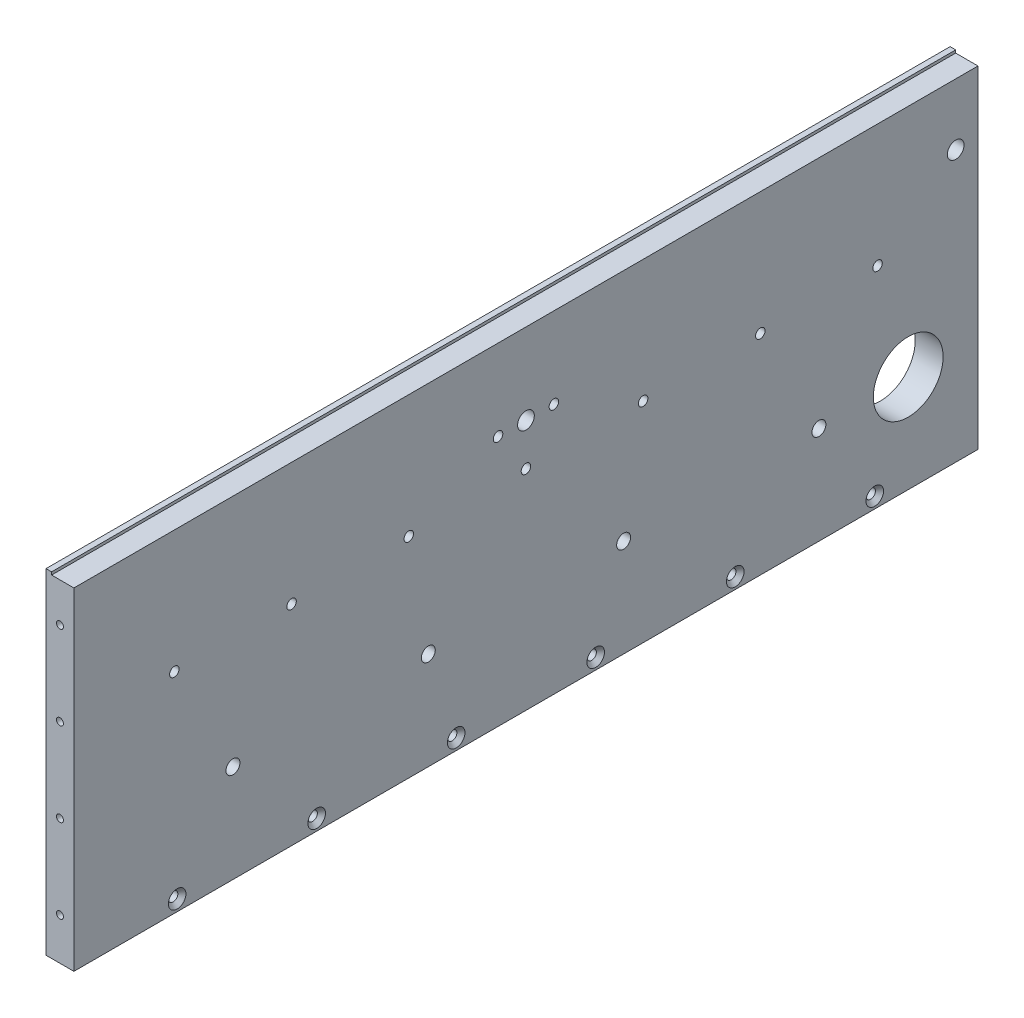
from build123d import *

# Parameters (mm, degrees)
SKETCH1_W                                       = 324
SKETCH1_H                                       = 40
BOSS_EXTRUDE1_DEPTH                             = 10
G1_4_TAPPED_HOLE1_D                             = 6
CSK_FOR_M3_COUNTERSUNK_FLAT_HEAD1_D             = 3.4
CSK_FOR_M3_COUNTERSUNK_FLAT_HEAD1_CSINK_D       = 6.3
CSK_FOR_M3_COUNTERSUNK_FLAT_HEAD1_CSINK_ANGLE   = 90
SKETCH9_W                                       = 10
SKETCH9_H                                       = 324
BOSS_EXTRUDE2_DEPTH                             = 80
CSK_FOR_M3_COUNTERSUNK_FLAT_HEAD2_D             = 3.4
CSK_FOR_M3_COUNTERSUNK_FLAT_HEAD2_DEPTH         = 11.5
CSK_FOR_M3_COUNTERSUNK_FLAT_HEAD2_CSINK_D       = 6.3
CSK_FOR_M3_COUNTERSUNK_FLAT_HEAD2_CSINK_ANGLE   = 90
CSK_FOR_M3_COUNTERSUNK_FLAT_HEAD2_TIP           = 1.021463052
M3X0_5_TAPPED_HOLE1_AT_2_COUNT                  = 2
M3X0_5_TAPPED_HOLE1_AT_2_PITCH                  = 30
M3X0_5_TAPPED_HOLE1_AT_3_COUNT                  = 2
M3X0_5_TAPPED_HOLE1_AT_3_PITCH                  = 60
M3X0_5_TAPPED_HOLE1_AT_4_COUNT                  = 2
M3X0_5_TAPPED_HOLE1_AT_4_PITCH                  = 90
SKETCH14_W                                      = 8
SKETCH14_H                                      = 324
CUT_EXTRUDE1_DEPTH                              = 1
CSK_FOR_M3_FLAT_HEAD_MACHINE_SCREW1_D           = 3.4
CSK_FOR_M3_FLAT_HEAD_MACHINE_SCREW1_CSINK_D     = 6.3
CSK_FOR_M3_FLAT_HEAD_MACHINE_SCREW1_CSINK_ANGLE = 90
LPATTERN1_COUNT                                 = 7
LPATTERN1_PITCH                                 = 42
SKETCH18_R                                      = 12.5
SKETCH18_R_2                                    = 2.5
MOD_CUT_DEPTH                                   = 191.641023917


with BuildPart() as part:
    # Sketch1 → Boss-Extrude1 (new body)
    with BuildSketch(Plane(origin=(0, 0, 0), x_dir=(0, 0, -1), z_dir=(1, 0, 0))):
        Rectangle(SKETCH1_W, SKETCH1_H)
    extrude(amount=BOSS_EXTRUDE1_DEPTH)

    # G1/4 Tapped Hole1 (through all)
    with Locations(Plane(origin=(0, -10, 0), x_dir=(0, 0, -1), z_dir=(-1, 0, 0))):
        with Locations((0, 0), (154, -7)):
            Hole(G1_4_TAPPED_HOLE1_D / 2)

    # CSK for M3 Countersunk Flat Head1 (through all)
    with Locations(Plane(origin=(0, -10, -10), x_dir=(0, 0, -1), z_dir=(-1, 0, 0))):
        with Locations((0, 0)):
            csk_for_m3_countersunk_flat_head1 = CounterSinkHole(CSK_FOR_M3_COUNTERSUNK_FLAT_HEAD1_D / 2, CSK_FOR_M3_COUNTERSUNK_FLAT_HEAD1_CSINK_D / 2, counter_sink_angle=CSK_FOR_M3_COUNTERSUNK_FLAT_HEAD1_CSINK_ANGLE)

    # Mirror1: CSK for M3 Countersunk Flat Head1 across plane
    add(csk_for_m3_countersunk_flat_head1.mirror(Plane.XY), mode=Mode.SUBTRACT)

    # Sketch9 → Boss-Extrude2 (add)
    with BuildSketch(Plane.XZ.offset(20)):
        with Locations((5, 0)):
            Rectangle(SKETCH9_W, SKETCH9_H)
    extrude(amount=BOSS_EXTRUDE2_DEPTH)

    # CSK for M3 Countersunk Flat Head2
    with Locations(Plane(origin=(10, -96, 125), x_dir=(0, 0, 1), z_dir=(1, 0, 0))):
        with Locations((0, 0), (-50, 0), (-100, 0), (-150, 0), (-200, 0), (-250, 0)):
            CounterSinkHole(CSK_FOR_M3_COUNTERSUNK_FLAT_HEAD2_D / 2, CSK_FOR_M3_COUNTERSUNK_FLAT_HEAD2_CSINK_D / 2, depth=CSK_FOR_M3_COUNTERSUNK_FLAT_HEAD2_DEPTH, counter_sink_angle=CSK_FOR_M3_COUNTERSUNK_FLAT_HEAD2_CSINK_ANGLE)
            with Locations((0, 0, -(CSK_FOR_M3_COUNTERSUNK_FLAT_HEAD2_DEPTH + CSK_FOR_M3_COUNTERSUNK_FLAT_HEAD2_TIP / 2))):  # 118° drill point
                Cone(0, CSK_FOR_M3_COUNTERSUNK_FLAT_HEAD2_D / 2, CSK_FOR_M3_COUNTERSUNK_FLAT_HEAD2_TIP, mode=Mode.SUBTRACT)

    # Sketch13 → M3x0.5 Tapped Hole1 (revolve, cut)
    with BuildSketch(Plane(origin=(5, 5, 162), x_dir=(0, -1, 0), z_dir=(1, 0, 0))):
        Polygon((0, 0), (0, 12.251075774), (1.25, 11.5), (1.25, 0), align=None)
    m3x0_5_tapped_hole1 = revolve(axis=Axis((5, 5, 168.35), (0, 0, -1)), mode=Mode.SUBTRACT)

    # M3x0.5 Tapped Hole1 at 2: M3x0.5 Tapped Hole1 ×2
    with Locations(*[(0, -i * M3X0_5_TAPPED_HOLE1_AT_2_PITCH, 0) for i in range(1, M3X0_5_TAPPED_HOLE1_AT_2_COUNT)]):
        add(m3x0_5_tapped_hole1, mode=Mode.SUBTRACT)

    # M3x0.5 Tapped Hole1 at 3: M3x0.5 Tapped Hole1 ×2
    with Locations(*[(0, -i * M3X0_5_TAPPED_HOLE1_AT_3_PITCH, 0) for i in range(1, M3X0_5_TAPPED_HOLE1_AT_3_COUNT)]):
        add(m3x0_5_tapped_hole1, mode=Mode.SUBTRACT)

    # M3x0.5 Tapped Hole1 at 4: M3x0.5 Tapped Hole1 ×2
    with Locations(*[(0, -i * M3X0_5_TAPPED_HOLE1_AT_4_PITCH, 0) for i in range(1, M3X0_5_TAPPED_HOLE1_AT_4_COUNT)]):
        add(m3x0_5_tapped_hole1, mode=Mode.SUBTRACT)

    # Mirror2: M3x0.5 Tapped Hole1 across plane
    add(m3x0_5_tapped_hole1.mirror(Plane.XY), mode=Mode.SUBTRACT)

    # Mirror2 copy 1 sketch → Mirror2 copy 1 (revolve, cut)
    with BuildSketch(Plane(origin=(5, -25, -162), x_dir=(0, -1, 0), z_dir=(1, 0, 0))):
        Polygon((0, 0), (0, -12.251075774), (1.25, -11.5), (1.25, 0), align=None)
    revolve(axis=Axis((5, -25, -168.35), (0, 0, -1)), mode=Mode.SUBTRACT)

    # Mirror2 copy 2 sketch → Mirror2 copy 2 (revolve, cut)
    with BuildSketch(Plane(origin=(5, -55, -162), x_dir=(0, -1, 0), z_dir=(1, 0, 0))):
        Polygon((0, 0), (0, -12.251075774), (1.25, -11.5), (1.25, 0), align=None)
    revolve(axis=Axis((5, -55, -168.35), (0, 0, -1)), mode=Mode.SUBTRACT)

    # Mirror2 copy 3 sketch → Mirror2 copy 3 (revolve, cut)
    with BuildSketch(Plane(origin=(5, -85, -162), x_dir=(0, -1, 0), z_dir=(1, 0, 0))):
        Polygon((0, 0), (0, -12.251075774), (1.25, -11.5), (1.25, 0), align=None)
    revolve(axis=Axis((5, -85, -168.35), (0, 0, -1)), mode=Mode.SUBTRACT)

    # Sketch14 → Cut-Extrude1 (cut)
    with BuildSketch(Plane(origin=(0, 20, 0), x_dir=(1, 0, 0), z_dir=(0, 1, 0))):
        with Locations((6, 0)):
            Rectangle(SKETCH14_W, SKETCH14_H)
    extrude(amount=-CUT_EXTRUDE1_DEPTH, mode=Mode.SUBTRACT)

    # CSK for M3 Flat Head Machine Screw1 (through all)
    with Locations(Plane(origin=(0, -25, -126), x_dir=(0, 0, -1), z_dir=(-1, 0, 0))):
        with Locations((0, 0)):
            csk_for_m3_flat_head_machine_screw1 = CounterSinkHole(CSK_FOR_M3_FLAT_HEAD_MACHINE_SCREW1_D / 2, CSK_FOR_M3_FLAT_HEAD_MACHINE_SCREW1_CSINK_D / 2, counter_sink_angle=CSK_FOR_M3_FLAT_HEAD_MACHINE_SCREW1_CSINK_ANGLE)

    # LPattern1: CSK for M3 Flat Head Machine Screw1 ×7
    with Locations(*[(0, 0, i * LPATTERN1_PITCH) for i in range(1, LPATTERN1_COUNT)]):
        add(csk_for_m3_flat_head_machine_screw1, mode=Mode.SUBTRACT)

    # Sketch18 → mod_cut (cut, through all)
    with BuildSketch(Plane.ZY):
        with Locations((-137, -65)):
            Circle(SKETCH18_R)
        with Locations((-105, -65)):
            Circle(SKETCH18_R_2)
        with Locations((-35, -65)):
            Circle(SKETCH18_R_2)
        with Locations((35, -65)):
            Circle(SKETCH18_R_2)
        with Locations((105, -65)):
            Circle(SKETCH18_R_2)
    extrude(amount=-MOD_CUT_DEPTH, mode=Mode.SUBTRACT)


solid = part.part
